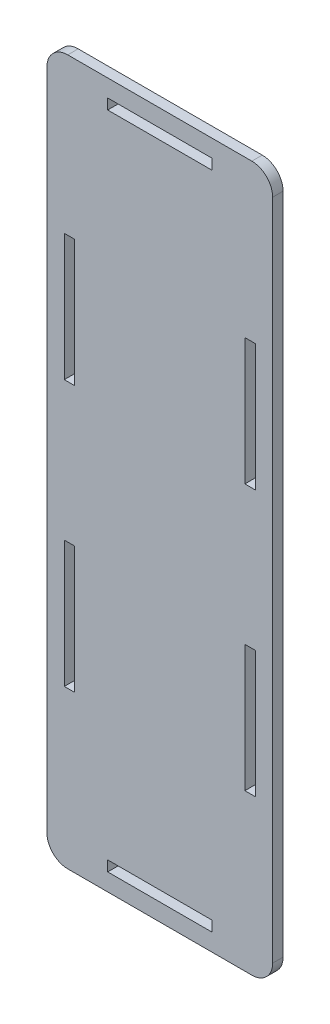
from build123d import *

# Parameters (mm, degrees)
BOSS_EXTRUDE1_DEPTH = 3
SKETCH2_W           = 3
SKETCH2_H           = 36.5
SKETCH2_W_2         = 30
SKETCH2_H_2         = 3
CUT_EXTRUDE1_DEPTH  = 3


with BuildPart() as part:
    # Sketch1 → Boss-Extrude1 (new body)
    with BuildSketch(Plane.XY):
        with BuildLine():
            Line((-26.5, 101.5), (26.5, 101.5))
            ThreePointArc((26.5, 101.5), (30.742640687, 99.742640687), (32.5, 95.5))
            Line((32.5, 95.5), (32.5, -95.5))
            ThreePointArc((32.5, -95.5), (30.742640687, -99.742640687), (26.5, -101.5))
            Line((26.5, -101.5), (-26.5, -101.5))
            ThreePointArc((-26.5, -101.5), (-30.742640687, -99.742640687), (-32.5, -95.5))
            Line((-32.5, -95.5), (-32.5, 95.5))
            ThreePointArc((-32.5, 95.5), (-30.742640687, 99.742640687), (-26.5, 101.5))
        make_face()
    extrude(amount=BOSS_EXTRUDE1_DEPTH)

    # Sketch2 → Cut-Extrude1 (cut)
    with BuildSketch(Plane.XY.offset(3)):
        with Locations((-26, 38.25)):
            Rectangle(SKETCH2_W, SKETCH2_H)
        with Locations((-26, -38.25)):
            Rectangle(SKETCH2_W, SKETCH2_H)
        with Locations((0, -95)):
            Rectangle(SKETCH2_W_2, SKETCH2_H_2)
        with Locations((0, 95)):
            Rectangle(SKETCH2_W_2, SKETCH2_H_2)
        with Locations((26, -38.25)):
            Rectangle(SKETCH2_W, SKETCH2_H)
        with Locations((26, 38.25)):
            Rectangle(SKETCH2_W, SKETCH2_H)
    extrude(amount=-CUT_EXTRUDE1_DEPTH, mode=Mode.SUBTRACT)


solid = part.part
